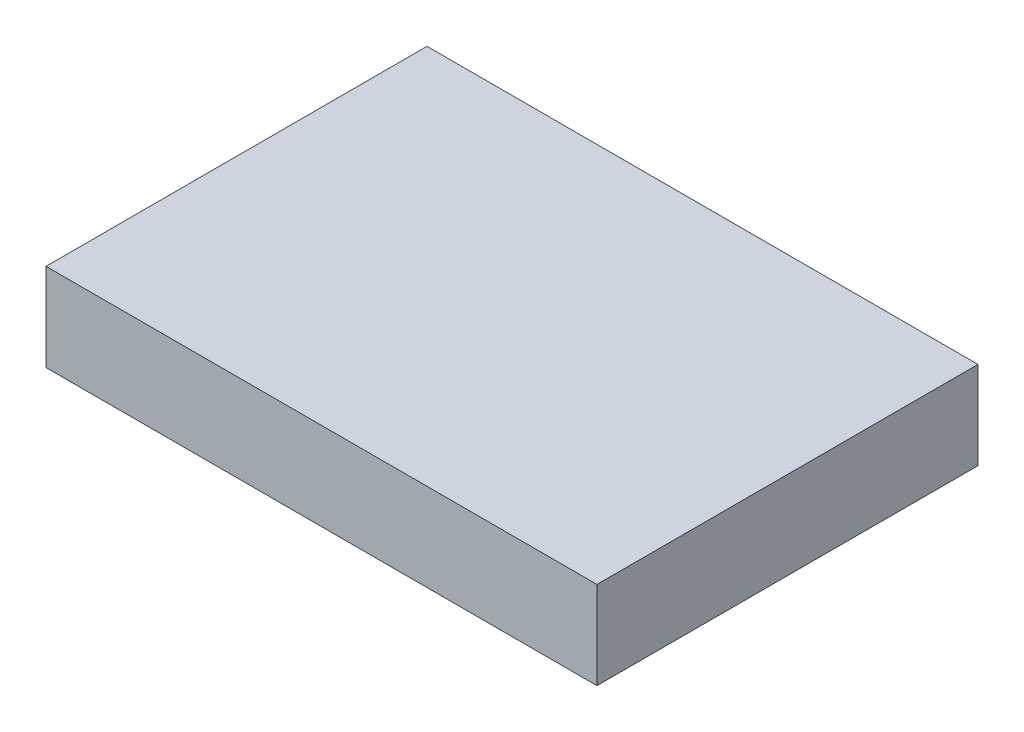
from build123d import *

# Parameters (mm, degrees)
SKETCH1_W           = 6.28341503
SKETCH1_H           = 4.345539367
BOSS_EXTRUDE1_DEPTH = 1


with BuildPart() as part:
    # Sketch1 → Boss-Extrude1 (new body)
    with BuildSketch(Plane(origin=(0, 0, 0), x_dir=(1, 0, 0), z_dir=(0, 1, 0))):
        with Locations((7.296951655, 12.254795085)):
            Rectangle(SKETCH1_W, SKETCH1_H)
    extrude(amount=BOSS_EXTRUDE1_DEPTH)


solid = part.part
